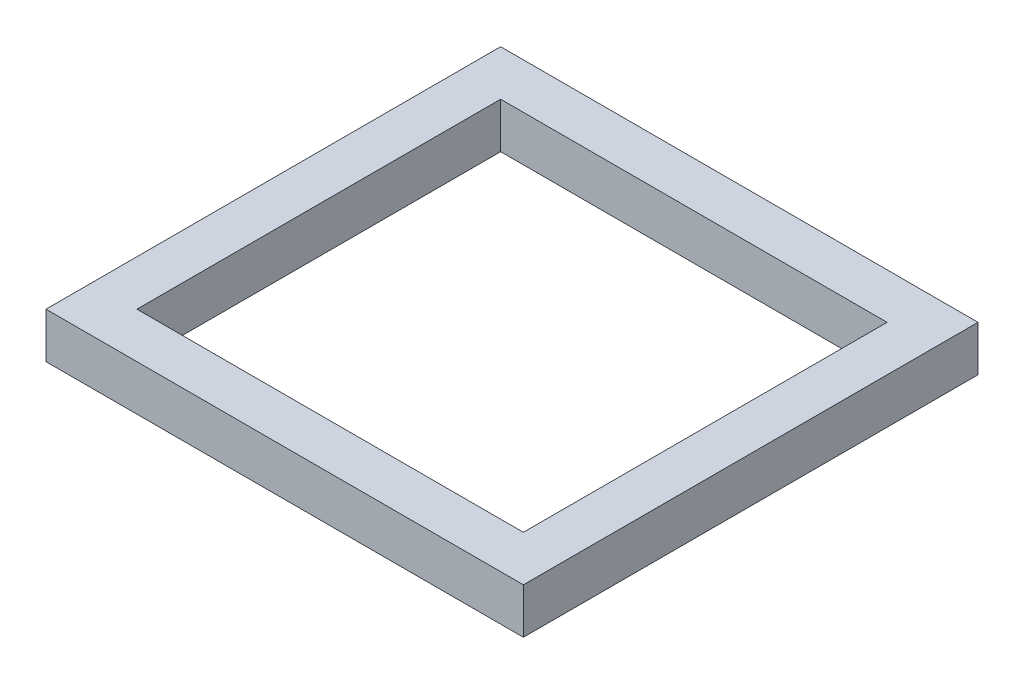
from build123d import *

# Parameters (mm, degrees)
SKETCH1_W           = 266.7
SKETCH1_H           = 254
SKETCH1_W_2         = 215.9
SKETCH1_H_2         = 203.2
BOSS_EXTRUDE1_DEPTH = 25.4


with BuildPart() as part:
    # Sketch1 → Boss-Extrude1 (new body)
    with BuildSketch(Plane(origin=(0, 0, 0), x_dir=(1, 0, 0), z_dir=(0, 1, 0))):
        Rectangle(SKETCH1_W, SKETCH1_H)
        Rectangle(SKETCH1_W_2, SKETCH1_H_2, mode=Mode.SUBTRACT)
    extrude(amount=BOSS_EXTRUDE1_DEPTH)


solid = part.part
